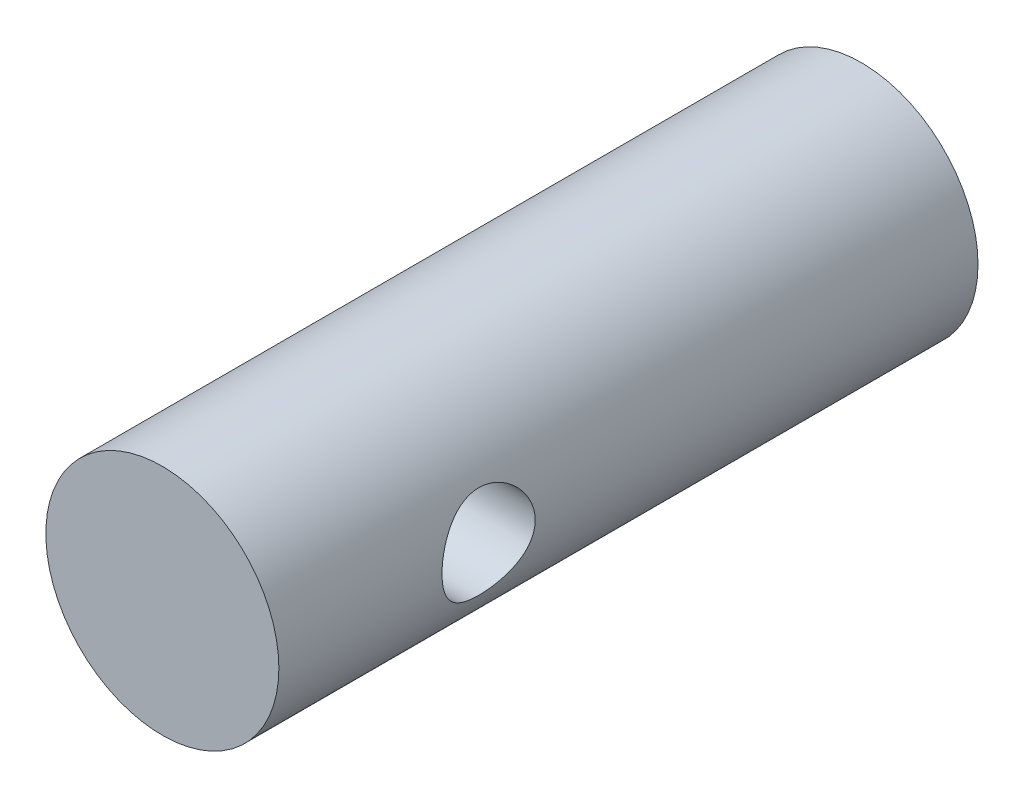
from build123d import *

# Parameters (mm, degrees)
SKETCH1_R           = 5
BOSS_EXTRUDE1_DEPTH = 30
CUT_EXTRUDE1_REACH  = 34.016
SKETCH2_R           = 2


with BuildPart() as part:
    # Sketch1 → Boss-Extrude1 (new body)
    with BuildSketch(Plane.XY):
        Circle(SKETCH1_R)
    extrude(amount=-BOSS_EXTRUDE1_DEPTH)

    # Sketch2 → Cut-Extrude1 (cut, up to next)
    with BuildSketch(Plane.ZY.offset(5), mode=Mode.PRIVATE) as cut_extrude1_sk1:
        with Locations((-9, 0)):
            Circle(SKETCH2_R)
    cut_extrude1_tool1 = extrude(cut_extrude1_sk1.sketch, amount=-CUT_EXTRUDE1_REACH, mode=Mode.PRIVATE) & part.part
    add(cut_extrude1_tool1.solids().sort_by_distance((-5, 0, -9))[0], mode=Mode.SUBTRACT)


solid = part.part
